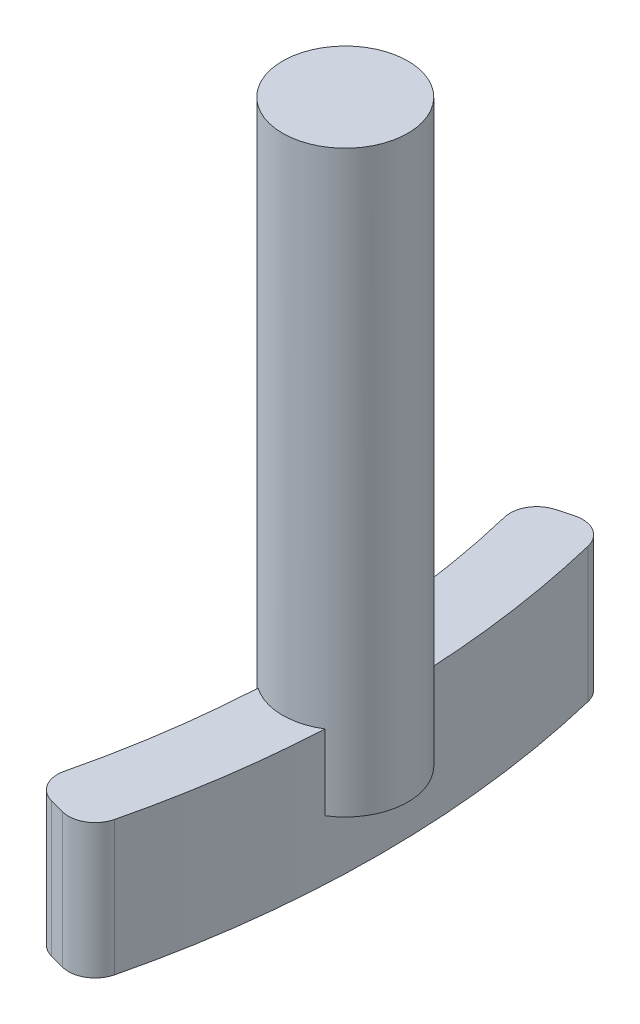
from build123d import *

# Parameters (mm, degrees)
EXTRUDE_1_DEPTH = 4.3
SKETCH_2_R      = 2
EXTRUDE_2_DEPTH = 18.5


with BuildPart() as part:
    # Эскиз1 → Бобышка-Вытянуть1 (new body)
    with BuildSketch(Plane(origin=(0, 0, 0), x_dir=(1, 0, 0), z_dir=(0, 1, 0))):
        with BuildLine():
            Line((-0.901247468, -8.05291062), (-0.418143138, -8.182358035))
            ThreePointArc((-0.418143138, -8.182358035), (0.23565654, -8.092289298), (0.627933419, -7.561549016))
            ThreePointArc((0.627933419, -7.561549016), (1.53125128, 0), (0.627933419, 7.561549016))
            ThreePointArc((0.627933419, 7.561549016), (0.23565654, 8.092289298), (-0.418143138, 8.182358035))
            Line((-0.418143138, 8.182358035), (-0.901247468, 8.05291062))
            ThreePointArc((-0.901247468, 8.05291062), (-1.412134812, 7.665819819), (-1.507409746, 7.031968217))
            ThreePointArc((-1.507409746, 7.031968217), (-0.66874872, 0), (-1.507409746, -7.031968217))
            ThreePointArc((-1.507409746, -7.031968217), (-1.412134812, -7.665819819), (-0.901247468, -8.05291062))
        make_face()
    extrude(amount=EXTRUDE_1_DEPTH)

    # Эскиз2 → Бобышка-Вытянуть2 (add)
    with BuildSketch(Plane(origin=(0, 1.9, 0), x_dir=(1, 0, 0), z_dir=(0, 1, 0))):
        with Locations(Location((0.43125128, 0, 0), (0, 0, 58.163304996))):
            Circle(SKETCH_2_R)
    extrude(amount=EXTRUDE_2_DEPTH)


solid = part.part
